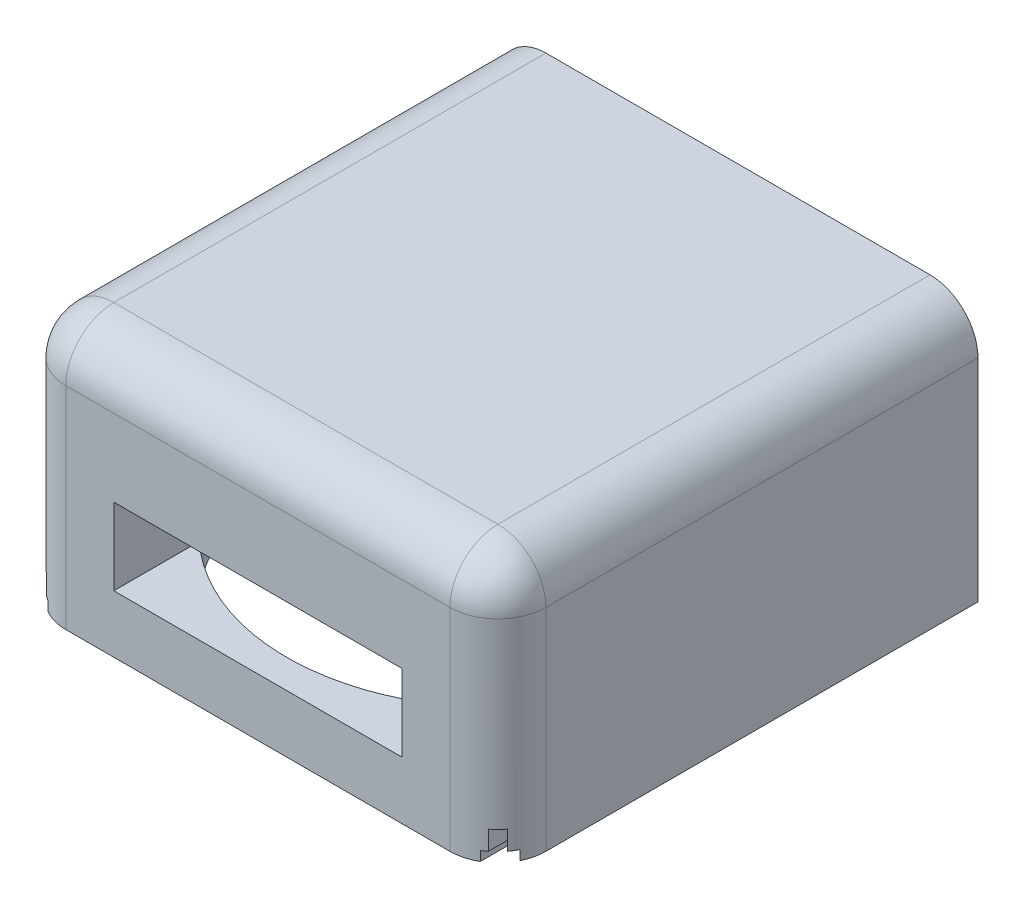
from build123d import *

# Parameters (mm, degrees)
CROQUIS1_W              = 60
CROQUIS1_H              = 25
SALIENTE_EXTRUIR1_DEPTH = 25
CROQUIS2_R              = 22
CORTAR_EXTRUIR1_DEPTH   = 25
CROQUIS3_W              = 39.331186887
CROQUIS3_H              = 32.545982132
CORTAR_EXTRUIR6_DEPTH   = 5
CROQUIS6_W              = 71.754194534
CROQUIS6_H              = 47.315533904
CORTAR_EXTRUIR7_DEPTH   = 5
CROQUIS7_W              = 50
CROQUIS7_H              = 25
SALIENTE_EXTRUIR2_DEPTH = 2
CORTAR_EXTRUIR9_DEPTH   = 38
CORTAR_EXTRUIR11_DEPTH  = 31
CROQUIS11_W             = 1
CROQUIS11_H             = 2
SALIENTE_EXTRUIR3_DEPTH = 25
CORTAR_EXTRUIR12_DEPTH  = 25
SALIENTE_EXTRUIR4_DEPTH = 25
CROQUIS14_W             = 30
CROQUIS14_H             = 8
CORTAR_EXTRUIR15_DEPTH  = 22
REDONDEO4_R             = 5
REDONDEO5_R             = 5


with BuildPart() as part:
    # Croquis1 → Saliente-Extruir1 (new body)
    with BuildSketch(Plane(origin=(0, 0, 0), x_dir=(1, 0, 0), z_dir=(0, 1, 0))):
        Rectangle(CROQUIS1_W, CROQUIS1_H)
    extrude(amount=SALIENTE_EXTRUIR1_DEPTH)

    # Croquis2 → Cortar-Extruir1 (cut)
    with BuildSketch(Plane(origin=(0, 25, 0), x_dir=(1, 0, 0), z_dir=(0, 1, 0))):
        with Locations((0, 12.5)):
            Circle(CROQUIS2_R)
    extrude(amount=-CORTAR_EXTRUIR1_DEPTH, mode=Mode.SUBTRACT)

    # Croquis3 → Cortar-Extruir6 (cut)
    with BuildSketch(Plane(origin=(30, 0, 0), x_dir=(0, 0, -1), z_dir=(1, 0, 0))):
        with Locations((0.690020822, 11.469590882)):
            Rectangle(CROQUIS3_W, CROQUIS3_H)
    extrude(amount=-CORTAR_EXTRUIR6_DEPTH, mode=Mode.SUBTRACT)

    # Croquis6 → Cortar-Extruir7 (cut)
    with BuildSketch(Plane.ZY.offset(30)):
        with Locations((-5.334444443, 15.165040004)):
            Rectangle(CROQUIS6_W, CROQUIS6_H)
    extrude(amount=-CORTAR_EXTRUIR7_DEPTH, mode=Mode.SUBTRACT)

    # Croquis7 → Saliente-Extruir2 (add)
    with BuildSketch(Plane(origin=(0, 25, 0), x_dir=(1, 0, 0), z_dir=(0, 1, 0))):
        Rectangle(CROQUIS7_W, CROQUIS7_H)
    extrude(amount=SALIENTE_EXTRUIR2_DEPTH)

    # Croquis8 → Cortar-Extruir9 (cut)
    with BuildSketch(Plane(origin=(0, 0, -12.5), x_dir=(-1, 0, 0), z_dir=(0, 0, -1))):
        Polygon((-23.5, 0), (-23, 0), (-23, 3), (-24, 3), (-24, 0), align=None)
        Polygon((24, 0), (23.5, 0), (23, 0), (23, 3), (24, 3), align=None)
    extrude(amount=-CORTAR_EXTRUIR9_DEPTH, mode=Mode.SUBTRACT)

    # Croquis10 → Cortar-Extruir11 (cut)
    with BuildSketch(Plane(origin=(0, 0, -12.5), x_dir=(-1, 0, 0), z_dir=(0, 0, -1))):
        Polygon((23, 0), (24, 0), (24.465135072, 0), (24.465135072, 1), (22.465135072, 1), (22.465135072, 0), align=None)
        Polygon((-22.465135072, 0), (-22.465135072, 1), (-24.465135072, 1), (-24.465135072, 0), (-24, 0), (-23, 0), align=None)
    extrude(amount=-CORTAR_EXTRUIR11_DEPTH, mode=Mode.SUBTRACT)

    # Croquis11 → Saliente-Extruir3 (add)
    with BuildSketch(Plane(origin=(0, 0, -12.5), x_dir=(-1, 0, 0), z_dir=(0, 0, -1))):
        Polygon((22.465135072, 1), (22.465135072, 0), (24.465135072, 0), (24.465135072, 1), (24, 1), (23, 1), align=None)
        with Locations((23.5, 2)):
            Rectangle(CROQUIS11_W, CROQUIS11_H)
        Polygon((-23, 1), (-24, 1), (-24.465135072, 1), (-24.465135072, 0), (-22.465135072, 0), (-22.465135072, 1), align=None)
        with Locations((-23.5, 2)):
            Rectangle(CROQUIS11_W, CROQUIS11_H)
    extrude(amount=-SALIENTE_EXTRUIR3_DEPTH)

    # Croquis12 → Cortar-Extruir12 (cut)
    with BuildSketch(Plane(origin=(0, 0, -12.5), x_dir=(-1, 0, 0), z_dir=(0, 0, -1))):
        Polygon((-22.5, 0), (-24.5, 0), (-24.5, 1), (-24, 1), (-24, 3), (-23, 3), (-23, 1), (-22.5, 1), align=None)
        Polygon((24, 3), (23, 3), (23, 1), (22.5, 1), (22.5, 0), (24.5, 0), (24.5, 1), (24, 1), align=None)
    extrude(amount=-CORTAR_EXTRUIR12_DEPTH, mode=Mode.SUBTRACT)

    # Croquis13 → Saliente-Extruir4 (add)
    with BuildSketch(Plane(origin=(0, 0, -12.5), x_dir=(-1, 0, 0), z_dir=(0, 0, -1))):
        Polygon((-22, 0), (-22.5, 0), (-22.5, 1), (-23, 1), (-23, 3), (-24, 3), (-24, 1), (-24.5, 1), (-24.5, 0), (-25, 0), (-25, 27), (25, 27), (25, 0), (24.5, 0), (24.5, 1), (24, 1), (24, 3), (23, 3), (23, 1), (22.5, 1), (22.5, 0), (22, 0), (22, 25), (-22, 25), align=None)
    extrude(amount=SALIENTE_EXTRUIR4_DEPTH)

    # Croquis14 → Cortar-Extruir15 (cut)
    with BuildSketch(Plane.XY.offset(12.5)):
        with Locations((0, 10)):
            Rectangle(CROQUIS14_W, CROQUIS14_H)
    extrude(amount=-CORTAR_EXTRUIR15_DEPTH, mode=Mode.SUBTRACT)

    # Redondeo4
    redondeo4_edges = [part.edges().sort_by_distance(p)[0] for p in [
        (0, 25, 9.5),
        (-22, 25, -25),
        (22, 25, -25),
        (-25, 27, -12.5),
        (25, 27, -12.5),
    ]]
    fillet(redondeo4_edges, radius=REDONDEO4_R)

    # Redondeo5
    redondeo5_edges = [part.edges().sort_by_distance(p)[0] for p in [
        (-23.535533906, 25.535533906, 12.5),
        (23.535533906, 25.535533906, 12.5),
        (-25, 11, 12.5),
        (0, 27, 12.5),
        (25, 11, 12.5),
    ]]
    fillet(redondeo5_edges, radius=REDONDEO5_R)


solid = part.part
